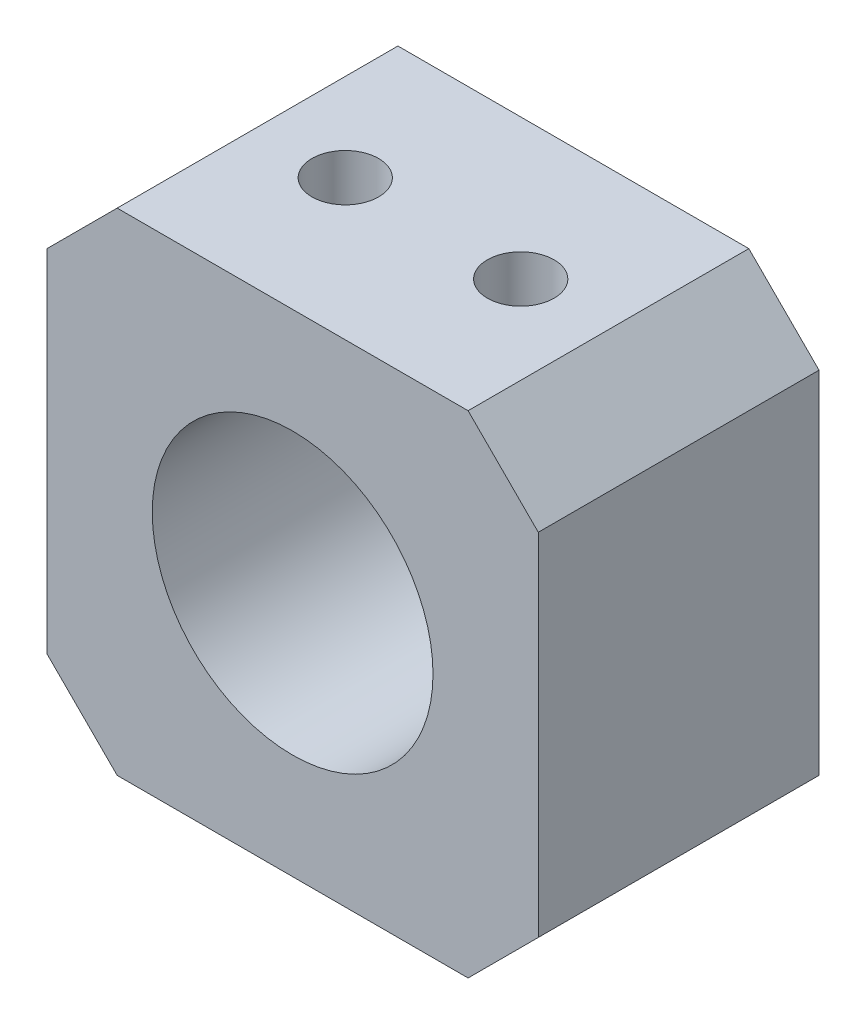
from build123d import *

# Parameters (mm, degrees)
SCHIZZO1_W                       = 7
SCHIZZO1_H                       = 7
SCHIZZO1_R                       = 2
ESTRUSIONE_ESTRUSIONE1_DEPTH     = 4
SMUSSO1_SIZE                     = 1
FORO_FILETTATO_M1_2X0_25_1_D     = 0.95
FORO_FILETTATO_M1_2X0_25_1_DEPTH = 1.2
FORO_FILETTATO_M1_2X0_25_1_TIP   = 0.285408794


with BuildPart() as part:
    # Schizzo1 → Estrusione-Estrusione1 (new body)
    with BuildSketch(Plane.XY):
        Rectangle(SCHIZZO1_W, SCHIZZO1_H)
        Circle(SCHIZZO1_R, mode=Mode.SUBTRACT)
    extrude(amount=ESTRUSIONE_ESTRUSIONE1_DEPTH)

    # Smusso1
    smusso1_edges = [part.edges().sort_by_distance(p)[0] for p in [
        (-3.5, 3.5, 2),
        (3.5, 3.5, 2),
        (3.5, -3.5, 2),
        (-3.5, -3.5, 2),
    ]]
    chamfer(smusso1_edges, length=SMUSSO1_SIZE)

    # Foro filettato M1.2x0.25-1
    with Locations(Plane(origin=(-1.25, 3.5, 2), x_dir=(1, 0, 0), z_dir=(0, 1, 0))):
        with Locations((0, 0), (2.5, 0)):
            Hole(FORO_FILETTATO_M1_2X0_25_1_D / 2, depth=FORO_FILETTATO_M1_2X0_25_1_DEPTH)
            with Locations((0, 0, -(FORO_FILETTATO_M1_2X0_25_1_DEPTH + FORO_FILETTATO_M1_2X0_25_1_TIP / 2))):  # 118° drill point
                Cone(0, FORO_FILETTATO_M1_2X0_25_1_D / 2, FORO_FILETTATO_M1_2X0_25_1_TIP, mode=Mode.SUBTRACT)


solid = part.part
